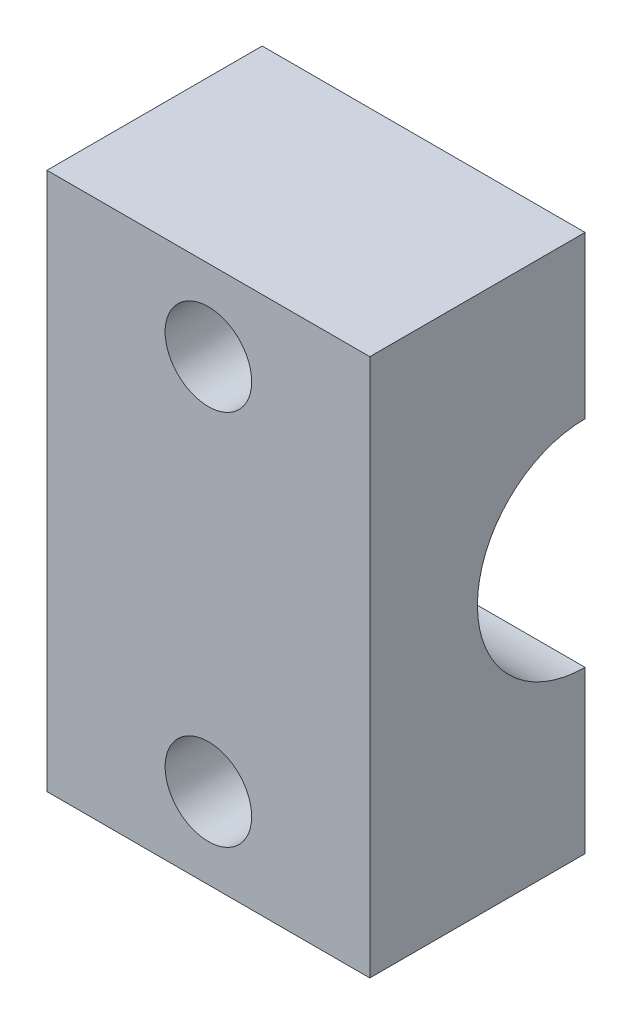
from build123d import *

# Parameters (mm, degrees)
SKETCH1_W               = 19.05
SKETCH1_H               = 31.75
BOSS_EXTRUDE1_DEPTH     = 12.7
SKETCH2_R               = 6.35
CUT_EXTRUDE1_DEPTH      = 28.86051193
F_1_4_20_TAPPED_HOLE1_D = 5.1054


with BuildPart() as part:
    # Sketch1 → Boss-Extrude1 (new body)
    with BuildSketch(Plane.XY):
        Rectangle(SKETCH1_W, SKETCH1_H)
    extrude(amount=BOSS_EXTRUDE1_DEPTH)

    # Sketch2 → Cut-Extrude1 (cut, through all)
    with BuildSketch(Plane(origin=(9.525, 0, 0), x_dir=(0, 0, -1), z_dir=(1, 0, 0))):
        Circle(SKETCH2_R)
    extrude(amount=-CUT_EXTRUDE1_DEPTH, mode=Mode.SUBTRACT)

    # 1/4-20 Tapped Hole1 (through all)
    with Locations(Plane.XY.offset(12.7)):
        with Locations((0, 11.1125), (0, -11.1125)):
            Hole(F_1_4_20_TAPPED_HOLE1_D / 2)


solid = part.part
